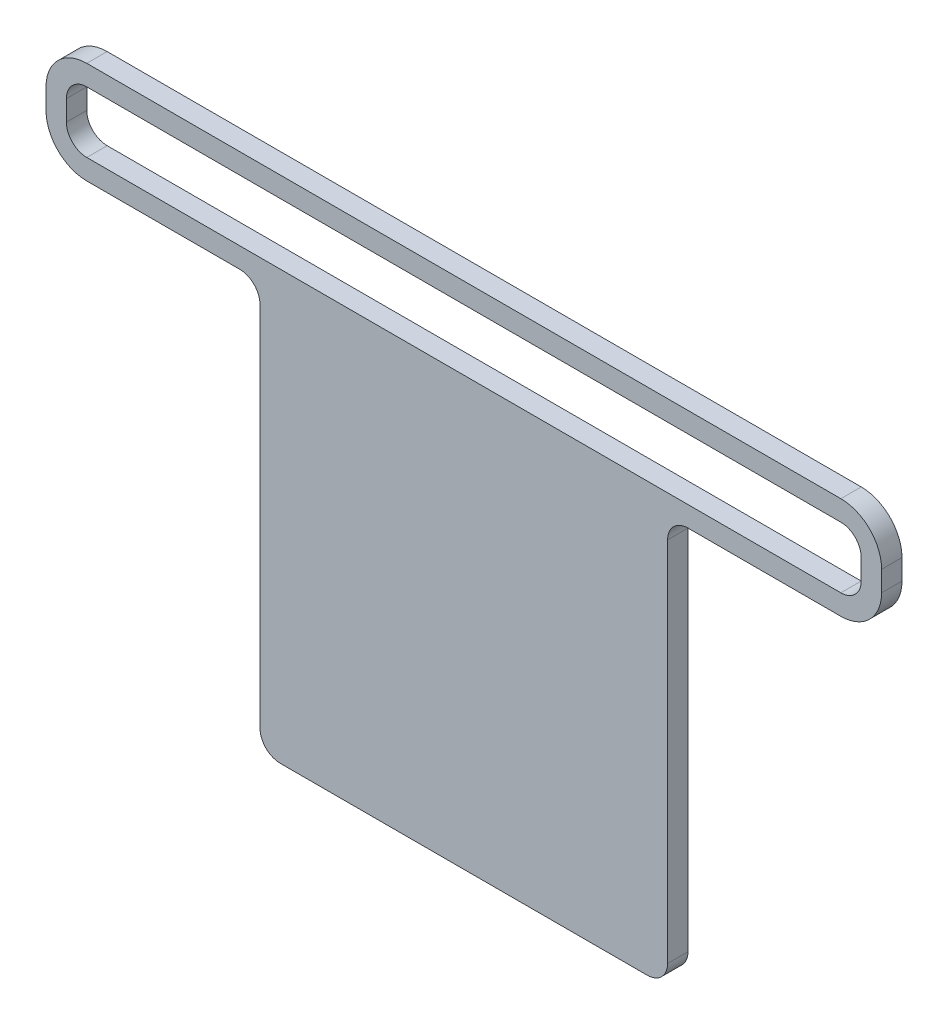
from build123d import *

# Parameters (mm, degrees)
BOSS_EXTRUDE1_DEPTH = 5


with BuildPart() as part:
    # Sketch1 → Boss-Extrude1 (new body)
    with BuildSketch(Plane.XY):
        with BuildLine():
            Line((105.70441989, 0), (143.20441989, 0))
            ThreePointArc((143.20441989, 0), (150.275487701, 2.928932188), (153.20441989, 10))
            Line((153.20441989, 10), (153.20441989, 15))
            ThreePointArc((153.20441989, 15), (150.275487701, 22.071067812), (143.20441989, 25))
            Line((143.20441989, 25), (-41.79558011, 25))
            ThreePointArc((-41.79558011, 25), (-48.866647922, 22.071067812), (-51.79558011, 15))
            Line((-51.79558011, 15), (-51.79558011, 10))
            ThreePointArc((-51.79558011, 10), (-48.866647922, 2.928932188), (-41.79558011, 0))
            Line((-41.79558011, 0), (-4.29558011, 0))
            ThreePointArc((-4.29558011, 0), (-0.760046205, -1.464466094), (0.70441989, -5))
            Line((0.70441989, -5), (0.70441989, -95))
            ThreePointArc((0.70441989, -95), (2.168885984, -98.535533906), (5.70441989, -100))
            Line((5.70441989, -100), (95.70441989, -100))
            ThreePointArc((95.70441989, -100), (99.239953795, -98.535533906), (100.70441989, -95))
            Line((100.70441989, -95), (100.70441989, -5))
            ThreePointArc((100.70441989, -5), (102.168885984, -1.464466094), (105.70441989, 0))
        make_face()
        with BuildLine():
            Line((-41.79558011, 20), (143.20441989, 20))
            ThreePointArc((143.20441989, 20), (146.739953795, 18.535533906), (148.20441989, 15))
            Line((148.20441989, 15), (148.20441989, 10))
            ThreePointArc((148.20441989, 10), (146.739953795, 6.464466094), (143.20441989, 5))
            Line((143.20441989, 5), (-41.79558011, 5))
            ThreePointArc((-41.79558011, 5), (-45.331114016, 6.464466094), (-46.79558011, 10))
            Line((-46.79558011, 10), (-46.79558011, 15))
            ThreePointArc((-46.79558011, 15), (-45.331114016, 18.535533906), (-41.79558011, 20))
        make_face(mode=Mode.SUBTRACT)
    extrude(amount=BOSS_EXTRUDE1_DEPTH)


solid = part.part
